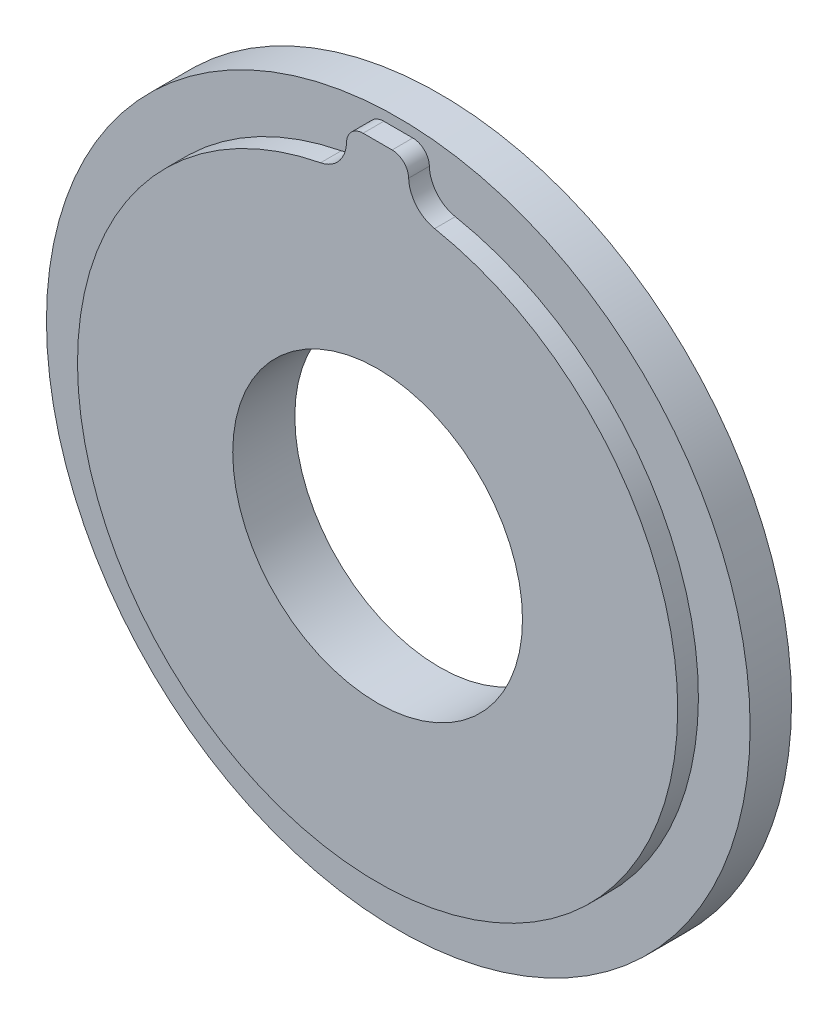
from build123d import *

# Parameters (mm, degrees)
SKETCH_1_R          = 17
EXTRUDE_1_DEPTH     = 2
EXTRUDE_2_DEPTH     = 1
FILLET_1_R          = 1.55
FILLET_2_R          = 0.8
SKETCH_3_R          = 7
CUT_EXTRUDE_1_DEPTH = 25.22808302


with BuildPart() as part:
    # ｽｹｯﾁ1 → ﾎﾞｽ - 押し出し1 (new body)
    with BuildSketch(Plane.XY):
        Circle(SKETCH_1_R)
    extrude(amount=EXTRUDE_1_DEPTH)

    # ｽｹｯﾁ2 → ﾎﾞｽ - 押し出し2 (add)
    with BuildSketch(Plane.XY.offset(2)):
        with BuildLine():
            Line((-1.5, 14.422205102), (-1.5, 12.5))
            Line((-1.5, 12.5), (1.5, 12.5))
            Line((1.5, 12.5), (1.5, 14.422205102))
            ThreePointArc((1.5, 14.422205102), (0, 14.5), (-1.5, 14.422205102))
        make_face()
        with BuildLine():
            Line((1.5, 12.5), (-1.5, 12.5))
            Line((-1.5, 12.5), (-1.5, 14.422205102))
            ThreePointArc((-1.5, 14.422205102), (-9.708243919, -10.770329614), (14.5, 0))
            ThreePointArc((14.5, 0), (10.770329614, 9.708243919), (1.5, 14.422205102))
            Line((1.5, 14.422205102), (1.5, 12.5))
        make_face()
        with BuildLine():
            Line((-1.5, 16.5), (-1.5, 14.422205102))
            ThreePointArc((-1.5, 14.422205102), (0, 14.5), (1.5, 14.422205102))
            Line((1.5, 14.422205102), (1.5, 16.5))
            Line((1.5, 16.5), (-1.5, 16.5))
        make_face()
    extrude(amount=EXTRUDE_2_DEPTH)

    # ﾌｨﾚｯﾄ1
    fillet_1_edges = [part.edges().sort_by_distance(p)[0] for p in [
        (-1.5, 14.422205102, 2.5),
        (1.5, 14.422205102, 2.5),
    ]]
    fillet(fillet_1_edges, radius=FILLET_1_R)

    # ﾌｨﾚｯﾄ2
    fillet_2_edges = [part.edges().sort_by_distance(p)[0] for p in [
        (1.5, 16.5, 2.5),
        (-1.5, 16.5, 2.5),
    ]]
    fillet(fillet_2_edges, radius=FILLET_2_R)

    # ｽｹｯﾁ3 → ｶｯﾄ - 押し出し1 (cut, through all)
    with BuildSketch(Plane.XY.offset(3)):
        Circle(SKETCH_3_R)
    extrude(amount=-CUT_EXTRUDE_1_DEPTH, mode=Mode.SUBTRACT)


solid = part.part
